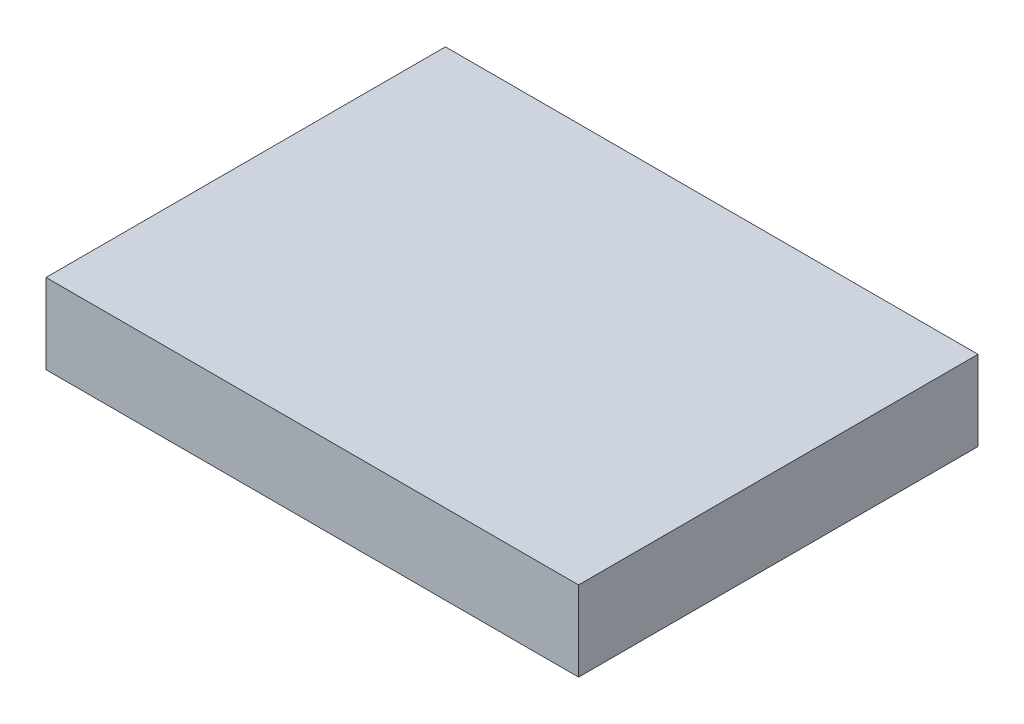
from build123d import *

# Parameters (mm, degrees)
SKETCH1_W           = 508
SKETCH1_H           = 381
BOSS_EXTRUDE1_DEPTH = 76.2


with BuildPart() as part:
    # Sketch1 → Boss-Extrude1 (new body)
    with BuildSketch(Plane(origin=(0, 0, 0), x_dir=(1, 0, 0), z_dir=(0, 1, 0))):
        Rectangle(SKETCH1_W, SKETCH1_H)
    extrude(amount=BOSS_EXTRUDE1_DEPTH)


solid = part.part
